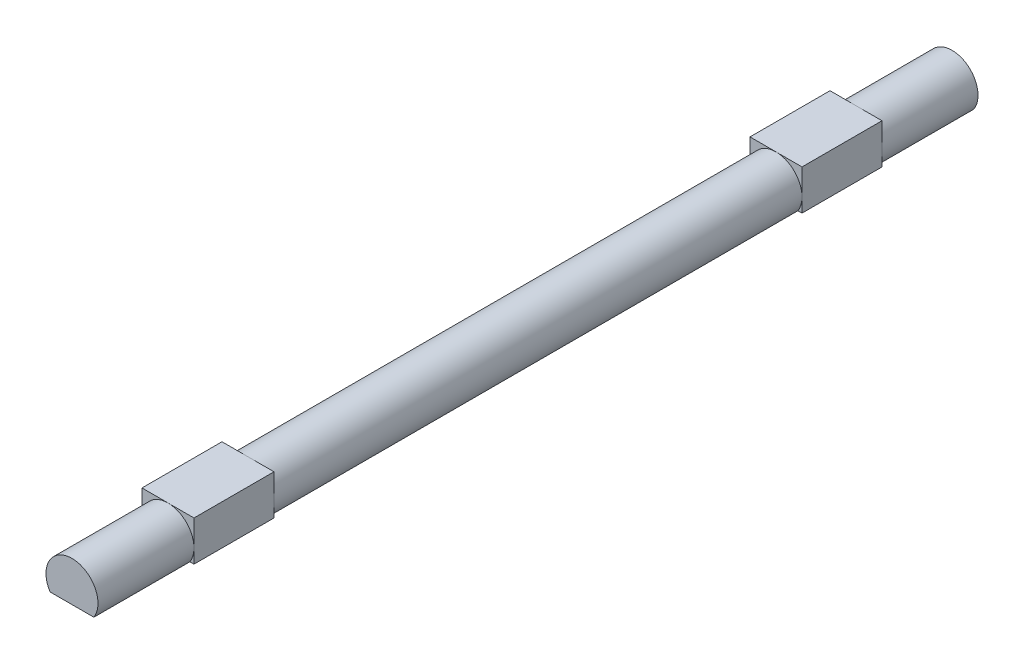
from build123d import *

# Parameters (mm, degrees)
BOSS_EXTRUDE1_DEPTH      = 55
BOSS_EXTRUDE1_DEPTH_BACK = 55
SKETCH4_W                = 6.5
SKETCH4_H                = 5.004744749
BOSS_EXTRUDE3_DEPTH      = 10


with BuildPart() as part:
    # Sketch2 → Boss-Extrude1 (new, two sides: drawn at the far end of the back side and taken through both)
    with BuildSketch(Plane.XY.offset(-BOSS_EXTRUDE1_DEPTH_BACK)):
        with BuildLine():
            Line((25.528440089, 3.245255251), (30.999590193, 3.245255251))
            ThreePointArc((30.999590193, 3.245255251), (31.382758391, 4.08570216), (31.514015141, 5))
            ThreePointArc((31.514015141, 5), (27.349717301, 8.11874325), (25.528440089, 3.245255251))
        make_face()
    extrude(amount=BOSS_EXTRUDE1_DEPTH + BOSS_EXTRUDE1_DEPTH_BACK)

    # Sketch4 → Boss-Extrude3 (add)
    with BuildSketch(Plane.XY.offset(43)):
        with Locations((28.264015141, 5.747627625)):
            Rectangle(SKETCH4_W, SKETCH4_H)
    boss_extrude3 = extrude(amount=-BOSS_EXTRUDE3_DEPTH)

    # Mirror1: Boss-Extrude3 across plane
    add(boss_extrude3.mirror(Plane.XY))


solid = part.part
